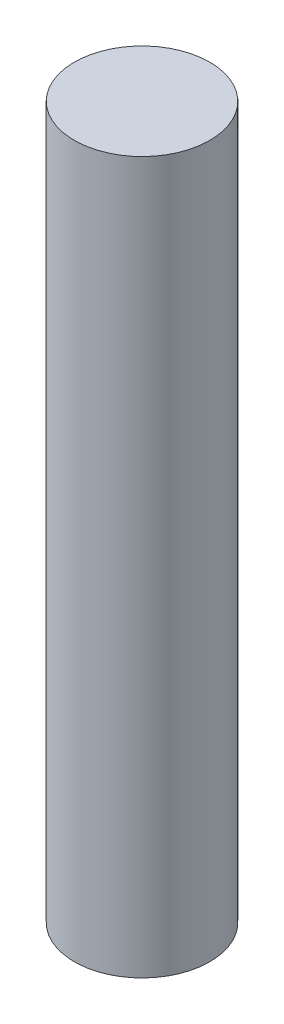
from build123d import *

# Parameters (mm, degrees)
SKETCH1_R           = 1
BOSS_EXTRUDE1_DEPTH = 10.5


with BuildPart() as part:
    # Sketch1 → Boss-Extrude1 (new body)
    with BuildSketch(Plane(origin=(0, 0, 0), x_dir=(1, 0, 0), z_dir=(0, 1, 0))):
        with Locations(Location((0, 0, 0), (0, 0, 90))):
            Circle(SKETCH1_R)
    extrude(amount=BOSS_EXTRUDE1_DEPTH)


solid = part.part
